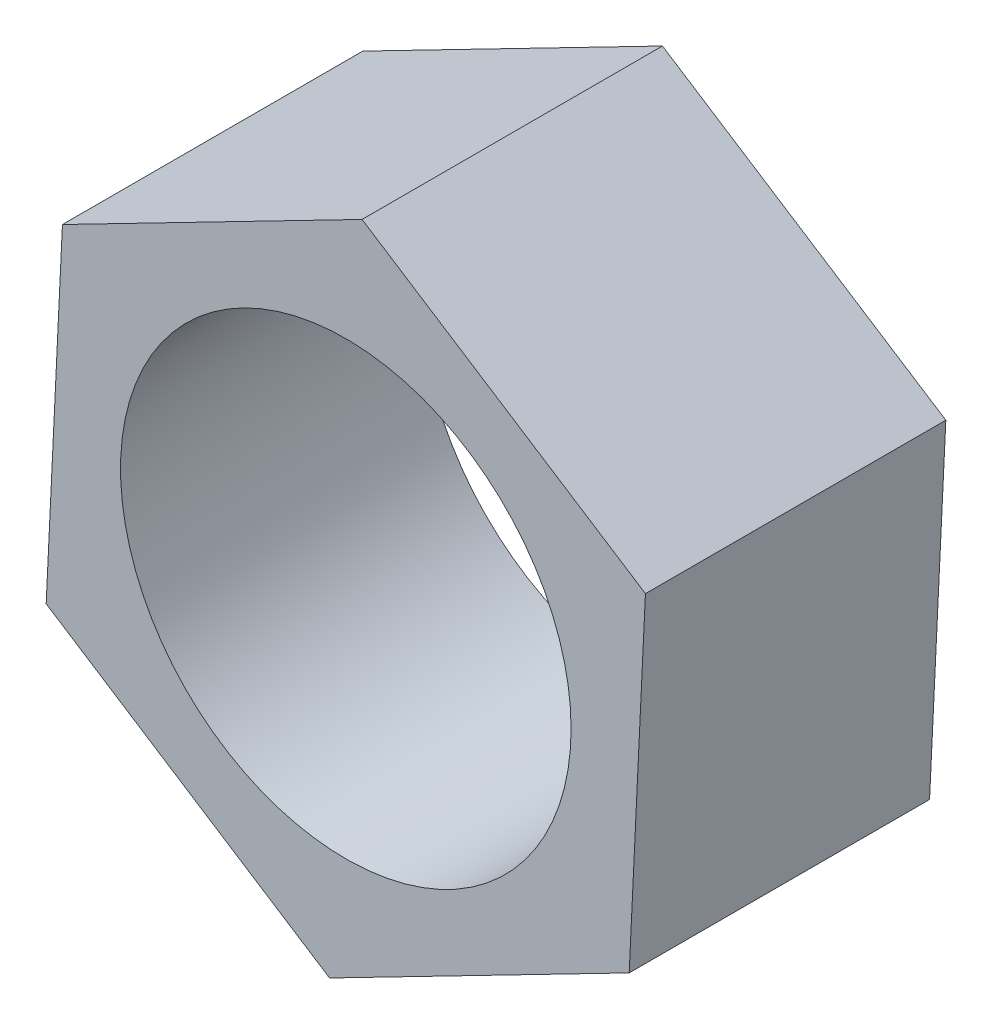
from build123d import *

# Parameters (mm, degrees)
SKETCH1_R           = 3
BOSS_EXTRUDE1_DEPTH = 4


with BuildPart() as part:
    # Sketch1 → Boss-Extrude1 (new body)
    with BuildSketch(Plane.XY):
        Polygon((0.216473193, 4.482268462), (-3.773521758, 2.428605515), (-3.989994951, -2.053662947), (-0.216473193, -4.482268462), (3.773521758, -2.428605515), (3.989994951, 2.053662947), align=None)
        Circle(SKETCH1_R, mode=Mode.SUBTRACT)
    extrude(amount=BOSS_EXTRUDE1_DEPTH)


solid = part.part
